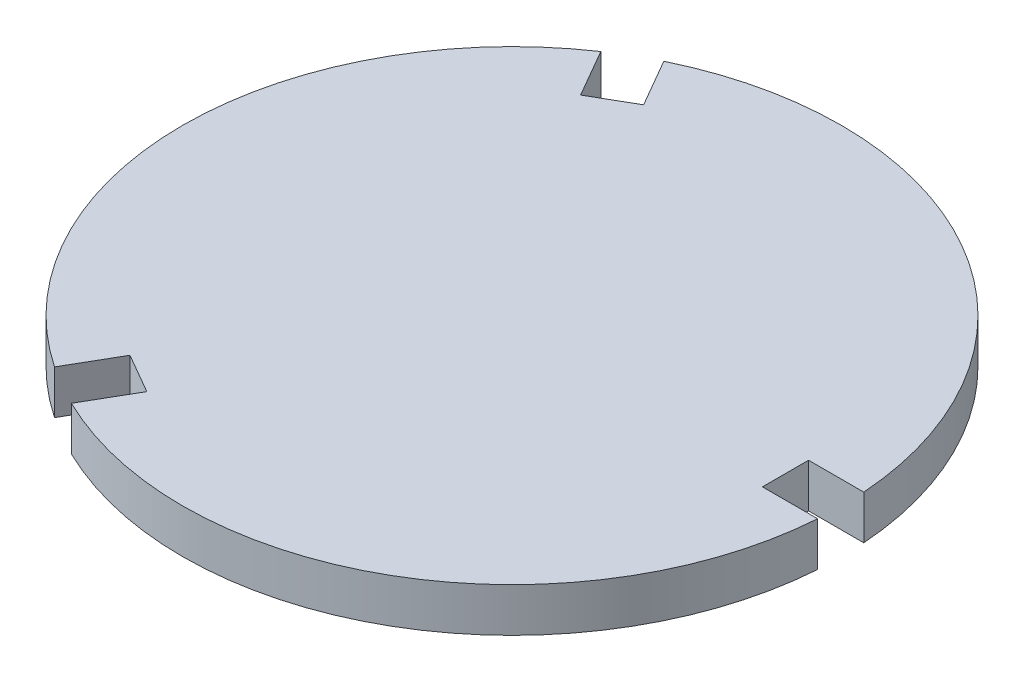
from build123d import *

# Parameters (mm, degrees)
CROQUIS1_R              = 30
SALIENTE_EXTRUIR1_DEPTH = 4
CORTAR_EXTRUIR2_REACH   = 44.615
CROQUIS2_W              = 10.2
CROQUIS2_H              = 4.2
MATRIZC1_COUNT          = 3


with BuildPart() as part:
    # Croquis1 → Saliente-Extruir1 (new body)
    with BuildSketch(Plane(origin=(0, 0, 0), x_dir=(1, 0, 0), z_dir=(0, 1, 0))):
        with Locations(Location((0, 0, 0), (0, 0, 270))):
            Circle(CROQUIS1_R)
    extrude(amount=SALIENTE_EXTRUIR1_DEPTH)

    # Croquis2 → Cortar-Extruir2 (cut, up to next)
    with BuildSketch(Plane(origin=(0, 0, 0), x_dir=(1, 0, 0), z_dir=(0, 1, 0)), mode=Mode.PRIVATE) as cortar_extruir2_sk1:
        with Locations((30, 0)):
            Rectangle(CROQUIS2_W, CROQUIS2_H)
    cortar_extruir2_tool1 = extrude(cortar_extruir2_sk1.sketch, amount=CORTAR_EXTRUIR2_REACH, mode=Mode.PRIVATE) & part.part
    cortar_extruir2 = cortar_extruir2_tool1.solids().sort_by_distance((30, 0, 0))[0]
    add(cortar_extruir2, mode=Mode.SUBTRACT)

    # MatrizC1: Cortar-Extruir2 ×3 about axis
    matrizc1_axis = Axis((0, 0, 0), (0, 1, 0))
    for i in range(1, MATRIZC1_COUNT):
        add(cortar_extruir2.rotate(matrizc1_axis, i * 360 / MATRIZC1_COUNT), mode=Mode.SUBTRACT)


solid = part.part
